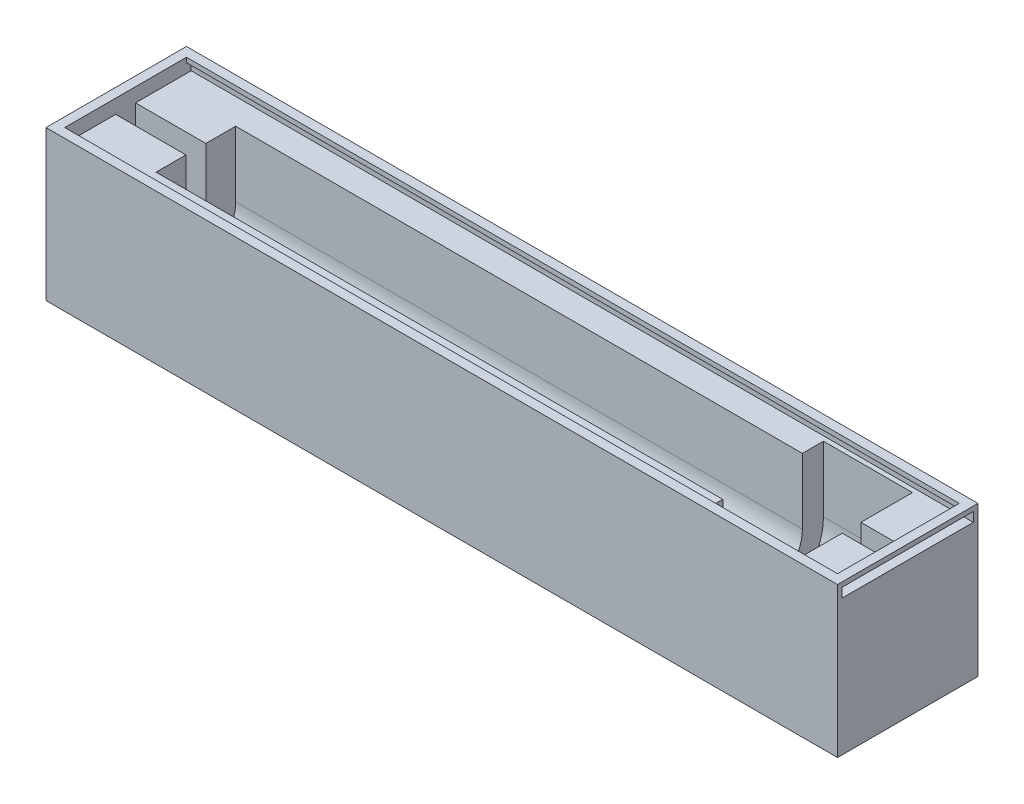
from build123d import *

# Parameters (mm, degrees)
BOSS_EXTRUDE1_DEPTH = 165
SKETCH3_W           = 30
SKETCH3_H           = 32
BOSS_EXTRUDE2_DEPTH = 2
SKETCH4_W           = 30
SKETCH4_H           = 32
BOSS_EXTRUDE3_DEPTH = 2
BOSS_EXTRUDE4_START = 10
BOSS_EXTRUDE4_DEPTH = 10
CUT_EXTRUDE1_DEPTH  = 10
BOSS_EXTRUDE6_DEPTH = 15
CUT_EXTRUDE2_DEPTH  = 15
BOSS_EXTRUDE7_DEPTH = 121
CUT_EXTRUDE3_DEPTH  = 121
SKETCH13_W          = 169
SKETCH13_H          = 30
CUT_EXTRUDE5_DEPTH  = 3
SKETCH14_W          = 169
SKETCH14_H          = 30
BOSS_EXTRUDE8_DEPTH = 3
SKETCH12_W          = 28
SKETCH12_H          = 2
CUT_EXTRUDE6_DEPTH  = 167
SKETCH16_W          = 165
SKETCH16_H          = 26
CUT_EXTRUDE7_DEPTH  = 3


with BuildPart() as part:
    # Sketch2 → Boss-Extrude1 (new body)
    with BuildSketch(Plane(origin=(0, 0, 0), x_dir=(0, 0, -1), z_dir=(1, 0, 0))):
        with BuildLine():
            Line((-13, 0), (-13, 17))
            Line((-13, 17), (-15, 17))
            Line((-15, 17), (-15, -15))
            Line((-15, -15), (15, -15))
            Line((15, -15), (15, 17))
            Line((15, 17), (13, 17))
            Line((13, 17), (13, 0))
            ThreePointArc((13, 0), (0, -13), (-13, 0))
        make_face()
    extrude(amount=BOSS_EXTRUDE1_DEPTH)

    # Sketch3 → Boss-Extrude2 (add)
    with BuildSketch(Plane(origin=(165, 0, 0), x_dir=(0, 0, -1), z_dir=(1, 0, 0))):
        with Locations((0, 1)):
            Rectangle(SKETCH3_W, SKETCH3_H)
    extrude(amount=BOSS_EXTRUDE2_DEPTH)

    # Sketch4 → Boss-Extrude3 (add)
    with BuildSketch(Plane.ZY):
        with Locations((0, 1)):
            Rectangle(SKETCH4_W, SKETCH4_H)
    extrude(amount=BOSS_EXTRUDE3_DEPTH)

    # Sketch5 → Boss-Extrude4 (add)
    with BuildSketch(Plane.ZY.offset(-165).offset(BOSS_EXTRUDE4_START)):
        with BuildLine():
            Line((-13, 17), (-13, 0))
            ThreePointArc((-13, 0), (0, -13), (13, 0))
            Line((13, 0), (13, 17))
            Line((13, 17), (-13, 17))
        make_face()
    extrude(amount=-BOSS_EXTRUDE4_DEPTH)

    # Sketch6 → Cut-Extrude1 (cut)
    with BuildSketch(Plane.ZY.offset(-155)):
        with BuildLine():
            Line((-2, 0), (-2, 17))
            Line((-2, 17), (2, 17))
            Line((2, 17), (2, 0))
            ThreePointArc((2, 0), (0, -2), (-2, 0))
        make_face()
    extrude(amount=-CUT_EXTRUDE1_DEPTH, mode=Mode.SUBTRACT)

    # Sketch8 → Boss-Extrude6 (add)
    with BuildSketch(Plane(origin=(0, 0, 0), x_dir=(0, 0, -1), z_dir=(1, 0, 0))):
        with BuildLine():
            Line((13, 0), (13, 17))
            Line((13, 17), (-13, 17))
            Line((-13, 17), (-13, 0))
            ThreePointArc((-13, 0), (0, -13), (13, 0))
        make_face()
    extrude(amount=BOSS_EXTRUDE6_DEPTH)

    # Sketch9 → Cut-Extrude2 (cut)
    with BuildSketch(Plane(origin=(15, 0, 0), x_dir=(0, 0, -1), z_dir=(1, 0, 0))):
        with BuildLine():
            Line((-2.125, 0), (-2.125, 17))
            Line((-2.125, 17), (2.125, 17))
            Line((2.125, 17), (2.125, 0))
            ThreePointArc((2.125, 0), (0, -2.125), (-2.125, 0))
        make_face()
    extrude(amount=-CUT_EXTRUDE2_DEPTH, mode=Mode.SUBTRACT)

    # Sketch10 → Boss-Extrude7 (add)
    with BuildSketch(Plane(origin=(15, 0, 0), x_dir=(0, 0, -1), z_dir=(1, 0, 0))):
        with BuildLine():
            Line((13, 0), (13, 17))
            Line((13, 17), (-13, 17))
            Line((-13, 17), (-13, 0))
            ThreePointArc((-13, 0), (0, -13), (13, 0))
        make_face()
    extrude(amount=BOSS_EXTRUDE7_DEPTH)

    # Sketch11 → Cut-Extrude3 (cut)
    with BuildSketch(Plane(origin=(136, 0, 0), x_dir=(0, 0, -1), z_dir=(1, 0, 0))):
        with BuildLine():
            Line((-8.5, 0), (-8.5, 17))
            Line((-8.5, 17), (8.5, 17))
            Line((8.5, 17), (8.5, 0))
            ThreePointArc((8.5, 0), (0, -8.5), (-8.5, 0))
        make_face()
    extrude(amount=-CUT_EXTRUDE3_DEPTH, mode=Mode.SUBTRACT)

    # Sketch13 → Cut-Extrude5 (cut)
    with BuildSketch(Plane(origin=(0, 17, 0), x_dir=(1, 0, 0), z_dir=(0, 1, 0))):
        with Locations((82.5, 0)):
            Rectangle(SKETCH13_W, SKETCH13_H)
    extrude(amount=-CUT_EXTRUDE5_DEPTH, mode=Mode.SUBTRACT)

    # Sketch14 → Boss-Extrude8 (add)
    with BuildSketch(Plane(origin=(0, 14, 0), x_dir=(1, 0, 0), z_dir=(0, 1, 0))):
        with Locations((82.5, 0)):
            Rectangle(SKETCH14_W, SKETCH14_H)
    extrude(amount=BOSS_EXTRUDE8_DEPTH)

    # Sketch12 → Cut-Extrude6 (cut)
    with BuildSketch(Plane(origin=(167, 0, 0), x_dir=(0, 0, -1), z_dir=(1, 0, 0))):
        with Locations((0, 15)):
            Rectangle(SKETCH12_W, SKETCH12_H)
    extrude(amount=-CUT_EXTRUDE6_DEPTH, mode=Mode.SUBTRACT)

    # Sketch16 → Cut-Extrude7 (cut)
    with BuildSketch(Plane(origin=(0, 17, 0), x_dir=(1, 0, 0), z_dir=(0, 1, 0))):
        with Locations((82.5, 0)):
            Rectangle(SKETCH16_W, SKETCH16_H)
    extrude(amount=-CUT_EXTRUDE7_DEPTH, mode=Mode.SUBTRACT)


solid = part.part
